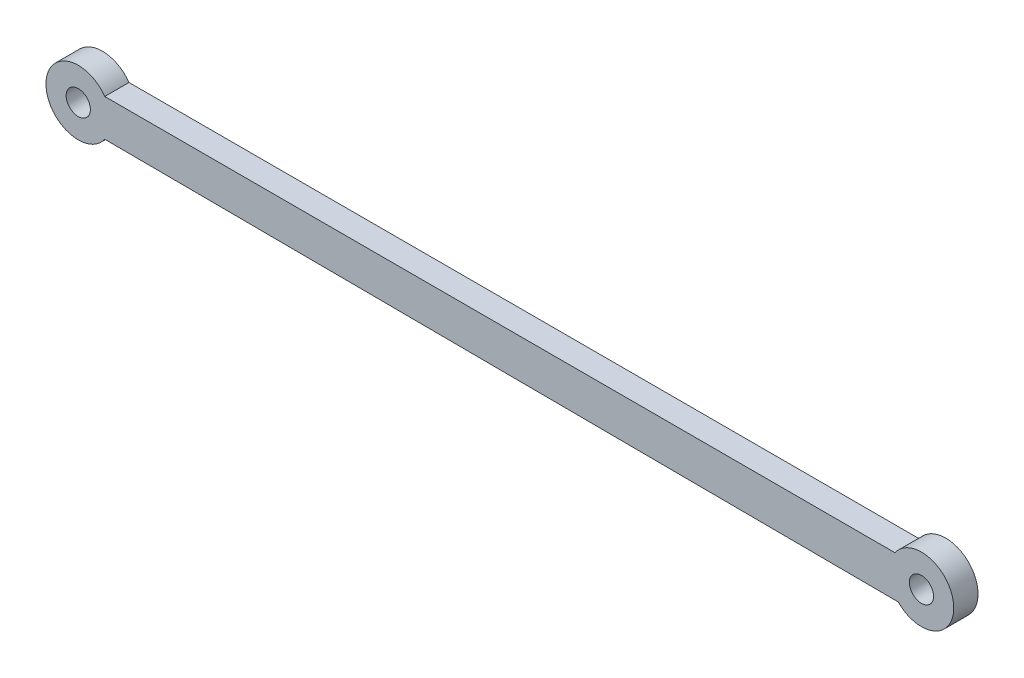
from build123d import *

# Parameters (mm, degrees)
SKETCH1_R           = 1.5
BOSS_EXTRUDE1_DEPTH = 3


with BuildPart() as part:
    # Sketch1 → Boss-Extrude1 (new body)
    with BuildSketch(Plane.XY):
        with BuildLine():
            Line((3.277615697, 2.292866185), (101.052384303, 2.292866185))
            ThreePointArc((101.052384303, 2.292866185), (108.317379891, 0.317492691), (101.456518667, -2.782643533))
            Line((101.456518667, -2.782643533), (3.277615697, -2.292866185))
            ThreePointArc((3.277615697, -2.292866185), (-4, 0), (3.277615697, 2.292866185))
        make_face()
        Circle(SKETCH1_R, mode=Mode.SUBTRACT)
        with Locations((104.33, 0)):
            Circle(SKETCH1_R, mode=Mode.SUBTRACT)
    extrude(amount=BOSS_EXTRUDE1_DEPTH)


solid = part.part
